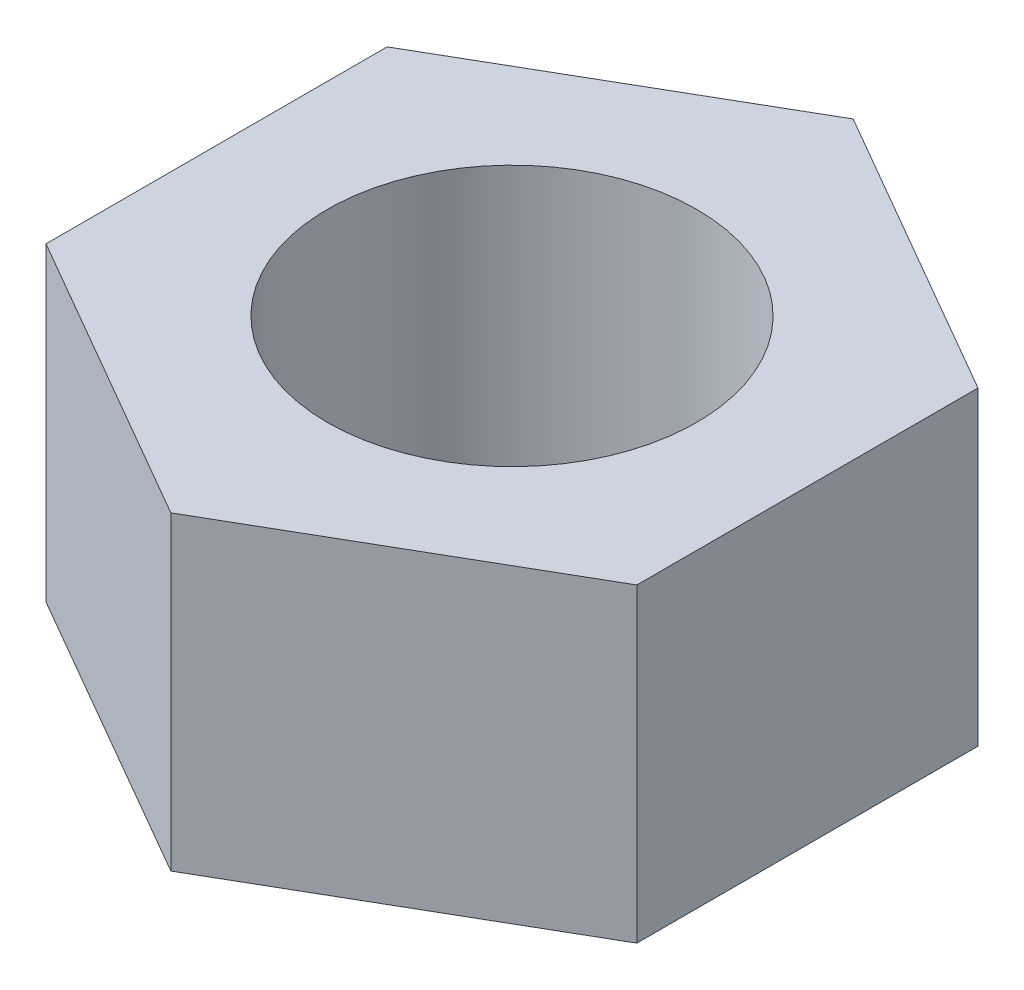
from build123d import *

# Parameters (mm, degrees)
BOSS_EXTRUDE1_DEPTH = 8.4
SKETCH2_R           = 5
CUT_EXTRUDE1_DEPTH  = 15.828800806


with BuildPart() as part:
    # Sketch1 → Boss-Extrude1 (new body)
    with BuildSketch(Plane(origin=(0, 0, 0), x_dir=(1, 0, 0), z_dir=(0, 1, 0))):
        Polygon((0, 9.237604307), (-8, 4.618802154), (-8, -4.618802154), (0, -9.237604307), (8, -4.618802154), (8, 4.618802154), align=None)
    extrude(amount=-BOSS_EXTRUDE1_DEPTH)

    # Sketch2 → Cut-Extrude1 (cut, through all)
    with BuildSketch(Plane(origin=(0, 0, 0), x_dir=(1, 0, 0), z_dir=(0, 1, 0))):
        with Locations(Location((0, 0, 0), (0, 0, 270))):
            Circle(SKETCH2_R)
    extrude(amount=-CUT_EXTRUDE1_DEPTH, mode=Mode.SUBTRACT)


solid = part.part
